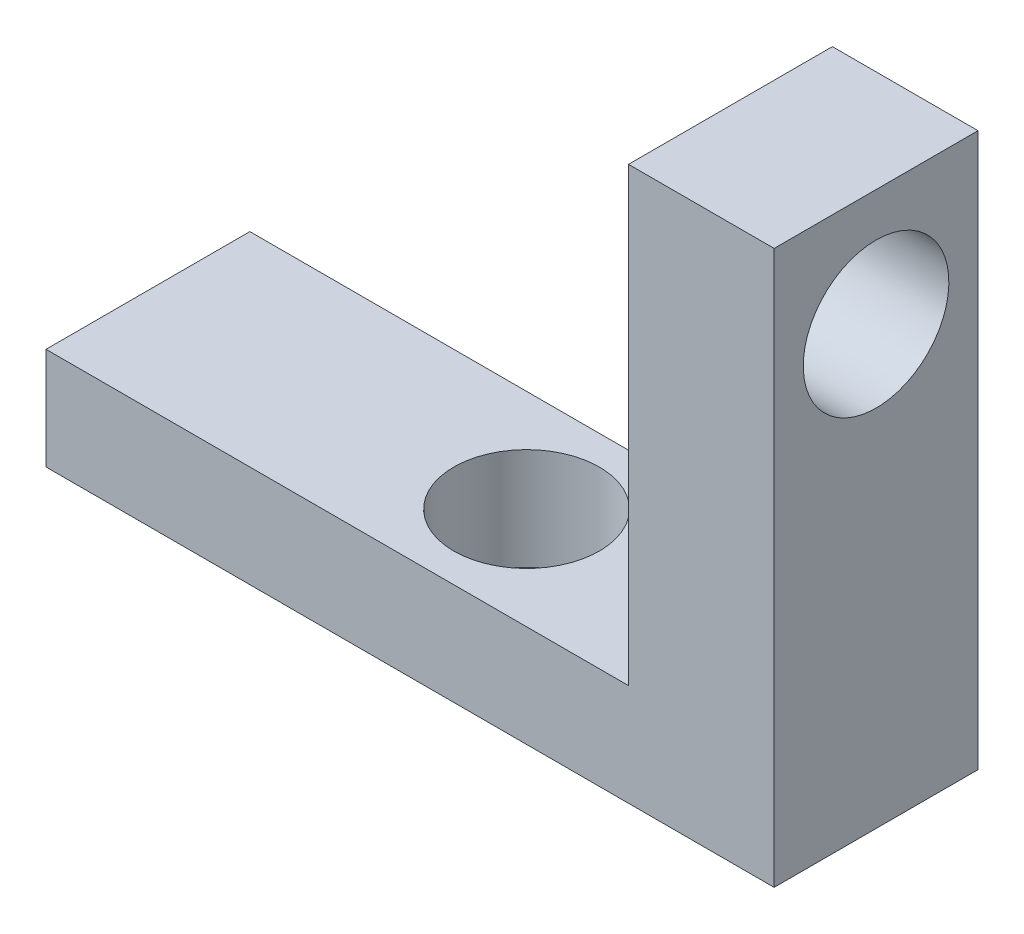
from build123d import *

# Parameters (mm, degrees)
SKETCH1_W           = 25
SKETCH1_H           = 19
BOSS_EXTRUDE1_DEPTH = 7
SKETCH2_W           = 20
SKETCH2_H           = 15.5
CUT_EXTRUDE1_DEPTH  = 7
SKETCH4_R           = 2.5
CUT_EXTRUDE3_DEPTH  = 22.106870919
SKETCH5_R           = 2.5
CUT_EXTRUDE4_DEPTH  = 10


with BuildPart() as part:
    # Sketch1 → Boss-Extrude1 (new body)
    with BuildSketch(Plane.XY):
        Rectangle(SKETCH1_W, SKETCH1_H)
    extrude(amount=BOSS_EXTRUDE1_DEPTH)

    # Sketch2 → Cut-Extrude1 (cut)
    with BuildSketch(Plane.XY.offset(7)):
        with Locations((-2.5, 1.75)):
            Rectangle(SKETCH2_W, SKETCH2_H)
    extrude(amount=-CUT_EXTRUDE1_DEPTH, mode=Mode.SUBTRACT)

    # Sketch4 → Cut-Extrude3 (cut, through all)
    with BuildSketch(Plane(origin=(0, -6, 0), x_dir=(1, 0, 0), z_dir=(0, 1, 0))):
        with Locations(Location((0.5, -3.5, 0), (0, 0, 270))):
            Circle(SKETCH4_R)
    extrude(amount=-CUT_EXTRUDE3_DEPTH, mode=Mode.SUBTRACT)

    # Sketch5 → Cut-Extrude4 (cut)
    with BuildSketch(Plane(origin=(12.5, 0, 0), x_dir=(0, 0, -1), z_dir=(1, 0, 0))):
        with Locations(Location((-3.5, 5.5, 0), (0, 0, 90))):
            Circle(SKETCH5_R)
    extrude(amount=-CUT_EXTRUDE4_DEPTH, mode=Mode.SUBTRACT)


solid = part.part
